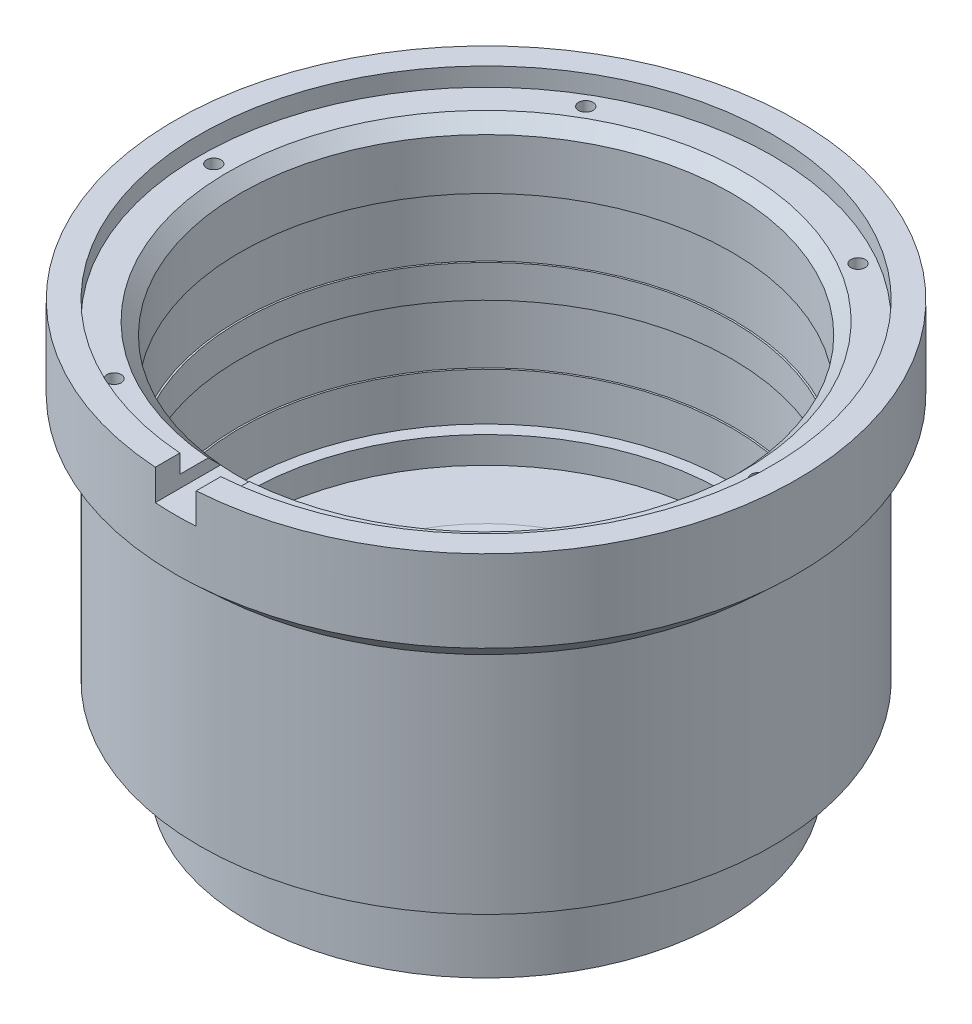
from build123d import *

# Parameters (mm, degrees)
TOP_CHAMFER_SIZE   = 1.5
BACK_CHAMFER_SIZE  = 2
BACK_CHAMFER_SIZE2 = 11.342563639
WIRE_START         = -3.75
SKETCH8_W          = 5
SKETCH8_H          = 8.066717416
WIRE_HOLE_DEPTH    = 3.75
SKETCH9_R          = 0.875
FRONT_HOLES_DEPTH  = 6
SKETCH10_R         = 1.375
BACK_HOLES_DEPTH   = 5
SKETCH14_W         = 0.21
SKETCH14_H         = 7.302222222


with BuildPart() as part:
    # Sketch7 → Base Motor Housing (revolve)
    with BuildSketch(Plane.XY, mode=Mode.PRIVATE) as base_motor_housing_sk:
        Polygon((-38, 38.06), (-35, 38.06), (-35, 35.81), (-30.0375, 35.81), (-30.0375, 3.255), (-29.075, 3.255), (-29.075, 0), (-9, 0), (-9, -2.94), (-12, -2.94), (-12, -13.19), (-38, -13.19), (-38, 3.255), align=None)
    revolve(base_motor_housing_sk.sketch.rotate(Axis((0, -30.231871117, 0), (0, 1, 0)), 270), axis=Axis((0, -30.231871117, 0), (0, 1, 0)))

    # Top Chamfer
    top_chamfer_edges = [part.edges().sort_by_distance(p)[0] for p in [
        (0, 35.81, 30.0375),
    ]]
    chamfer(top_chamfer_edges, length=TOP_CHAMFER_SIZE)

    # Back Chamfer
    back_chamfer_edges = [part.edges().sort_by_distance(p)[0] for p in [
        (0, 0, 9),
    ]]
    back_chamfer_side = [part.faces().sort_by_distance(p)[0] for p in [
        (0, -1.47, 9),
    ]]
    chamfer(back_chamfer_edges, length=BACK_CHAMFER_SIZE, length2=BACK_CHAMFER_SIZE2, reference=back_chamfer_side[0])

    # Sketch8 → Wire Hole (cut)
    with BuildSketch(Plane(origin=(0, 38.06, 0), x_dir=(1, 0, 0), z_dir=(0, 1, 0)).offset(WIRE_START)):
        with Locations((0, -33.966641292)):
            Rectangle(SKETCH8_W, SKETCH8_H)
    extrude(amount=WIRE_HOLE_DEPTH, mode=Mode.SUBTRACT)

    # Sketch9 → Front-Holes (cut)
    with BuildSketch(Plane(origin=(0, 35.81, 0), x_dir=(1, 0, 0), z_dir=(0, 1, 0))):
        with Locations(Location((-33.26875, 0, 0), (0, 0, 270))):
            Circle(SKETCH9_R)
        with Locations(Location((-16.634375, 28.811582652, 0), (0, 0, 270))):
            Circle(SKETCH9_R)
        with Locations(Location((16.634375, 28.811582652, 0), (0, 0, 270))):
            Circle(SKETCH9_R)
        with Locations(Location((33.26875, 0, 0), (0, 0, 270))):
            Circle(SKETCH9_R)
        with Locations(Location((16.634375, -28.811582652, 0), (0, 0, 270))):
            Circle(SKETCH9_R)
        with Locations(Location((-16.634375, -28.811582652, 0), (0, 0, 270))):
            Circle(SKETCH9_R)
    extrude(amount=-FRONT_HOLES_DEPTH, mode=Mode.SUBTRACT)

    # Sketch10 → Back-Holes (cut)
    with BuildSketch(Plane.XZ.offset(13.19)):
        with Locations(Location((-25, 0, 0), (0, 0, 270))):
            Circle(SKETCH10_R)
        with Locations(Location((-12.5, 21.650635095, 0), (0, 0, 270))):
            Circle(SKETCH10_R)
        with Locations(Location((12.5, 21.650635095, 0), (0, 0, 270))):
            Circle(SKETCH10_R)
        with Locations(Location((25, 0, 0), (0, 0, 270))):
            Circle(SKETCH10_R)
        with Locations(Location((12.5, -21.650635095, 0), (0, 0, 270))):
            Circle(SKETCH10_R)
        with Locations(Location((-12.5, -21.650635095, 0), (0, 0, 270))):
            Circle(SKETCH10_R)
    extrude(amount=-BACK_HOLES_DEPTH, mode=Mode.SUBTRACT)

    # Sketch11 → Lightening Cut (revolve, cut)
    with BuildSketch(Plane.XY, mode=Mode.PRIVATE) as lightening_cut_sk:
        Polygon((29, -13.19), (29, -5.69), (35, -2.225898385), (35, 25.274101615), (38, 28.06), (38, -13.19), align=None)
    revolve(lightening_cut_sk.sketch.rotate(Axis((0, 0, 0), (0, -1, 0)), 90), axis=Axis((0, 0, 0), (0, -1, 0)), mode=Mode.SUBTRACT)

    # Sketch12 → Undercut for Stator (revolve, cut)
    with BuildSketch(Plane.XY, mode=Mode.PRIVATE) as undercut_for_stator_sk:
        Polygon((-30.0375, 3.255), (-30.7875, 3.255), (-30.0375, 3.688012702), align=None)
    revolve(undercut_for_stator_sk.sketch.rotate(Axis((0, -4.281937273, 0), (0, 1, 0)), 270), axis=Axis((0, -4.281937273, 0), (0, 1, 0)), mode=Mode.SUBTRACT)

    # Sketch14 → Adhesive Trench (revolve, cut)
    with BuildSketch(Plane.XY, mode=Mode.PRIVATE) as adhesive_trench_sk:
        with Locations((-30.1425, 24.433611111)):
            Rectangle(SKETCH14_W, SKETCH14_H)
        with Locations((-30.1425, 13.131388889)):
            Rectangle(SKETCH14_W, SKETCH14_H)
    revolve(adhesive_trench_sk.sketch.rotate(Axis((0, -10.498587948, 0), (0, 1, 0)), 270), axis=Axis((0, -10.498587948, 0), (0, 1, 0)), mode=Mode.SUBTRACT)


solid = part.part
